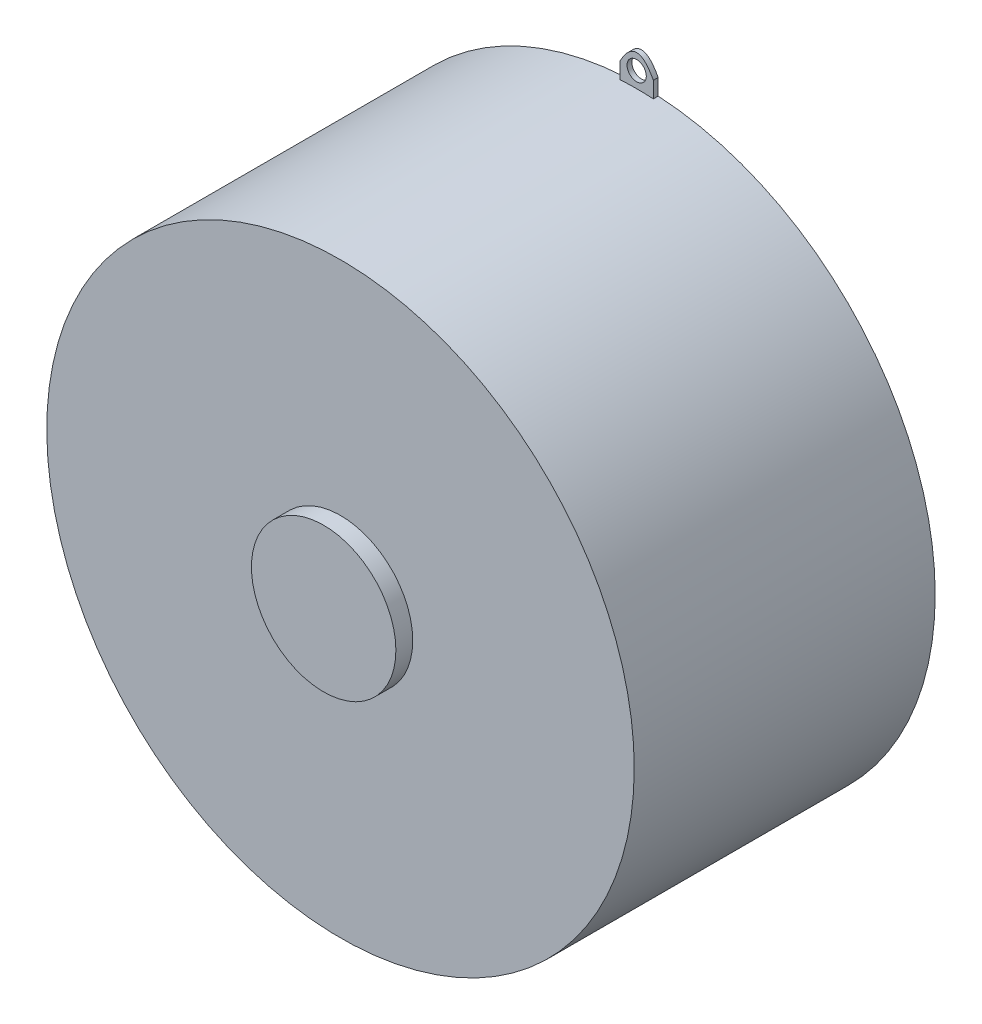
from build123d import *

# Parameters (mm, degrees)
SKETCH_1_R               = 12.2
EXTRUDE_1_DEPTH          = 12.5
SKETCH_2_R               = 3
EXTRUDE_2_DEPTH          = 0.7
SKETCH_3_R               = 3.25
EXTRUDE_3_DEPTH          = 1
SKETCH_4_R               = 1
EXTRUDE_4_DEPTH          = 4.3
SKETCH_5_R               = 0.85
CUT_EXTRUDE_1_DEPTH      = 0.35
CUT_EXTRUDE_START        = -0.5
SKETCH_6_R               = 3.25
SKETCH_6_R_2             = 1
CUT_EXTRUDE_2_DEPTH      = 0.5
SKETCH_8_R               = 0.4
EXTRUDE_6_DEPTH          = 0.2
CUT_EXTRUDE_3_DEPTH      = 2
CUT_EXTRUDE_3_DEPTH_BACK = 1.1
SKETCH_9_R               = 0.4


with BuildPart() as part:
    # 草图1 → 凸台-拉伸1 (new body)
    with BuildSketch(Plane.XY):
        Circle(SKETCH_1_R)
    extrude(amount=EXTRUDE_1_DEPTH)

    # 草图2 → 凸台-拉伸2 (add)
    with BuildSketch(Plane.XY.offset(12.5)):
        Circle(SKETCH_2_R)
    extrude(amount=EXTRUDE_2_DEPTH)

    # 草图3 → 凸台-拉伸3 (add)
    with BuildSketch(Plane(origin=(0, 0, 0), x_dir=(-1, 0, 0), z_dir=(0, 0, -1))):
        Circle(SKETCH_3_R)
    extrude(amount=EXTRUDE_3_DEPTH)

    # 草图4 → 凸台-拉伸4 (add)
    with BuildSketch(Plane(origin=(0, 0, -1), x_dir=(-1, 0, 0), z_dir=(0, 0, -1))):
        with Locations(Location((0, 0, 0), (0, 0, 180))):
            Circle(SKETCH_4_R)
    extrude(amount=EXTRUDE_4_DEPTH)

    # 草图5 → 切除-拉伸1 (cut)
    with BuildSketch(Plane(origin=(0, 0, 0), x_dir=(-1, 0, 0), z_dir=(0, 0, -1))):
        with Locations((0, 8.25)):
            Circle(SKETCH_5_R)
        with Locations((7.144709581, 4.125)):
            Circle(SKETCH_5_R)
        with Locations((7.144709581, -4.125)):
            Circle(SKETCH_5_R)
        with Locations((0, -8.25)):
            Circle(SKETCH_5_R)
        with Locations((-7.144709581, -4.125)):
            Circle(SKETCH_5_R)
        with Locations((-7.144709581, 4.125)):
            Circle(SKETCH_5_R)
    extrude(amount=-CUT_EXTRUDE_1_DEPTH, mode=Mode.SUBTRACT)

    # 草图6 → 切除-拉伸2 (cut)
    with BuildSketch(Plane(origin=(0, 0, -1), x_dir=(-1, 0, 0), z_dir=(0, 0, -1)).offset(CUT_EXTRUDE_START)):
        Circle(SKETCH_6_R)
        with Locations(Location((0, 0, 0), (0, 0, 180))):
            Circle(SKETCH_6_R_2, mode=Mode.SUBTRACT)
    extrude(amount=CUT_EXTRUDE_2_DEPTH, mode=Mode.SUBTRACT)

    # 草图8 → 凸台-拉伸6 (add)
    # profile 1 of 2: a face of its own
    with BuildSketch(Plane(origin=(0, 0, 0), x_dir=(-1, 0, 0), z_dir=(0, 0, -1))):
        with BuildLine():
            Line((0.694469448, 12.85), (0.694469448, 12.180218068))
            add(Edge.make_bspline(
                [(0.694469448, 12.180218068), (0, 12.219781932), (-0.694469448, 12.180218068)],
                knots=[0, 0, 0, 1, 1, 1], degree=2))
            Line((-0.694469448, 12.180218068), (-0.694469448, 12.85))
            add(Edge.make_bspline(
                [(0.694469448, 12.85), (0, 14.15), (-0.694469448, 12.85)],
                knots=[0, 0, 0, 1, 1, 1], degree=2))
        make_face()
        with Locations((0, 12.85)):
            Circle(SKETCH_8_R, mode=Mode.SUBTRACT)
    # profile 2 of 2: a face of its own
    with BuildSketch(Plane(origin=(0, 0, 0), x_dir=(-1, 0, 0), z_dir=(0, 0, -1))):
        with BuildLine():
            Line((-0.694469448, -12.85), (-0.694469448, -12.180218068))
            add(Edge.make_bspline(
                [(0.694469448, -12.180218068), (0, -12.219781932), (-0.694469448, -12.180218068)],
                knots=[0, 0, 0, 1, 1, 1], degree=2))
            Line((0.694469448, -12.180218068), (0.694469448, -12.85))
            add(Edge.make_bspline(
                [(0.694469448, -12.85), (0, -14.15), (-0.694469448, -12.85)],
                knots=[0, 0, 0, 1, 1, 1], degree=2))
        make_face()
        with Locations((0, -12.85)):
            Circle(SKETCH_8_R, mode=Mode.SUBTRACT)
    extrude(amount=-EXTRUDE_6_DEPTH)

    # 草图9 → 切除-拉伸3 (cut, two sides: drawn at the far end of the back side and taken through both)
    with BuildSketch(Plane(origin=(-65.68529626, 3.340628685, 41.676272609), x_dir=(0, 0, -1), z_dir=(0.08103812035682426, 0.9967110027731373, 1.0147062402532315e-14)).offset(-CUT_EXTRUDE_3_DEPTH_BACK)):
        with Locations(Location((43.872176256, -65.74, 0), (0, 0, 270))):
            Circle(SKETCH_9_R)
    extrude(amount=CUT_EXTRUDE_3_DEPTH + CUT_EXTRUDE_3_DEPTH_BACK, mode=Mode.SUBTRACT)


solid = part.part
